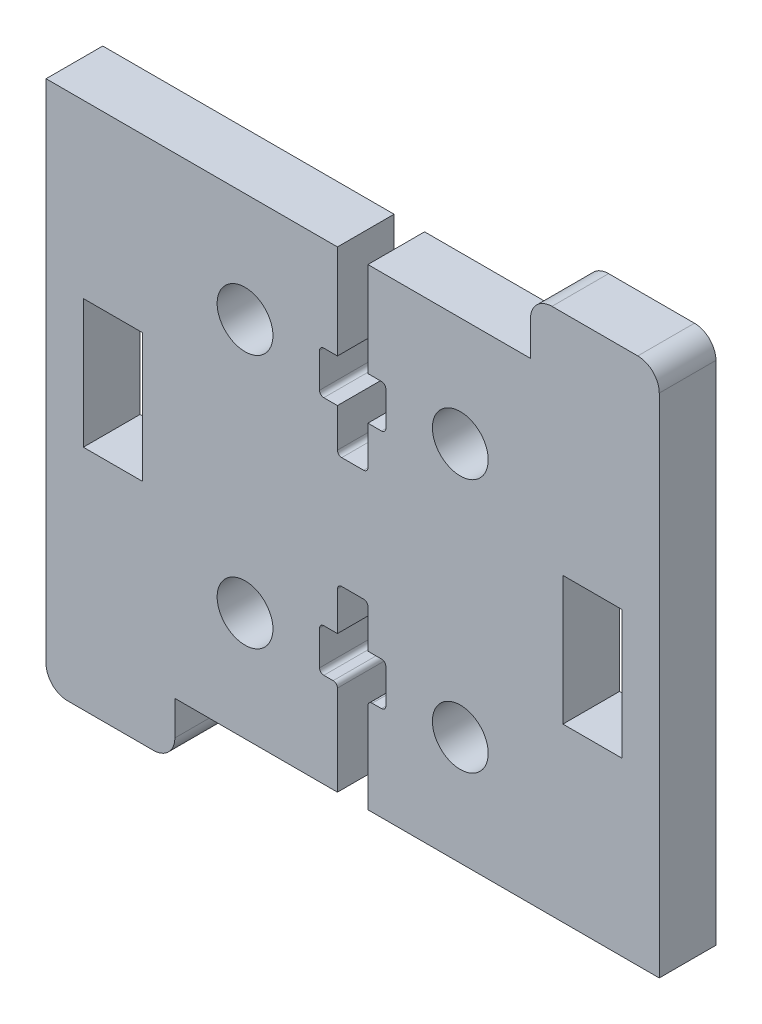
from build123d import *

# Parameters (mm, degrees)
MODEL_R             = 3.25
MODEL_W             = 6.88
MODEL_H             = 15
BOSS_EXTRUDE1_DEPTH = 6.6


with BuildPart() as part:
    # Model → Boss-Extrude1 (new body)
    with BuildSketch(Plane.XY):
        with BuildLine():
            Line((39.57, 15.5), (39.57, 11.5))
            ThreePointArc((39.57, 11.5), (39.423553391, 11.146446609), (39.07, 11))
            Line((39.07, 11), (37.985, 11))
            ThreePointArc((37.985, 11), (37.631446609, 10.853553391), (37.485, 10.5))
            Line((37.485, 10.5), (37.485, 0))
            Line((37.485, 0), (71.42, 0))
            Line((71.42, 0), (71.42, 59))
            ThreePointArc((71.42, 59), (70.687766953, 60.767766953), (68.92, 61.5))
            Line((68.92, 61.5), (58.92, 61.5))
            ThreePointArc((58.92, 61.5), (57.152233047, 60.767766953), (56.42, 59))
            Line((56.42, 59), (56.42, 55))
            Line((56.42, 55), (37.485, 55))
            Line((37.485, 55), (37.485, 44))
            Line((37.485, 44), (39.07, 44))
            ThreePointArc((39.07, 44), (39.423553391, 43.853553391), (39.57, 43.5))
            Line((39.57, 43.5), (39.57, 39.5))
            ThreePointArc((39.57, 39.5), (39.423553391, 39.146446609), (39.07, 39))
            Line((39.07, 39), (37.485, 39))
            Line((37.485, 39), (37.485, 34.5))
            ThreePointArc((37.485, 34.5), (37.338553391, 34.146446609), (36.985, 34))
            Line((36.985, 34), (34.435, 34))
            ThreePointArc((34.435, 34), (34.081446609, 34.146446609), (33.935, 34.5))
            Line((33.935, 34.5), (33.935, 39))
            Line((33.935, 39), (32.35, 39))
            ThreePointArc((32.35, 39), (31.996446609, 39.146446609), (31.85, 39.5))
            Line((31.85, 39.5), (31.85, 43.5))
            ThreePointArc((31.85, 43.5), (31.996446609, 43.853553391), (32.35, 44))
            Line((32.35, 44), (33.935, 44))
            Line((33.935, 44), (33.935, 55))
            Line((33.935, 55), (0, 55))
            Line((0, 55), (0, -4))
            ThreePointArc((0, -4), (0.732233047, -5.767766953), (2.5, -6.5))
            Line((2.5, -6.5), (12.5, -6.5))
            ThreePointArc((12.5, -6.5), (14.267766953, -5.767766953), (15, -4))
            Line((15, -4), (15, 0))
            Line((15, 0), (33.935, 0))
            Line((33.935, 0), (33.935, 10.5))
            ThreePointArc((33.935, 10.5), (33.788553391, 10.853553391), (33.435, 11))
            Line((33.435, 11), (32.35, 11))
            ThreePointArc((32.35, 11), (31.996446609, 11.146446609), (31.85, 11.5))
            Line((31.85, 11.5), (31.85, 15.5))
            ThreePointArc((31.85, 15.5), (31.996446609, 15.853553391), (32.35, 16))
            Line((32.35, 16), (33.935, 16))
            Line((33.935, 16), (33.935, 20.5))
            ThreePointArc((33.935, 20.5), (34.081446609, 20.853553391), (34.435, 21))
            Line((34.435, 21), (36.985, 21))
            ThreePointArc((36.985, 21), (37.338553391, 20.853553391), (37.485, 20.5))
            Line((37.485, 20.5), (37.485, 16))
            Line((37.485, 16), (39.07, 16))
            ThreePointArc((39.07, 16), (39.423553391, 15.853553391), (39.57, 15.5))
        make_face()
        with Locations((23.174807377, 12.7)):
            Circle(MODEL_R, mode=Mode.SUBTRACT)
        with Locations((23.174807377, 42.3)):
            Circle(MODEL_R, mode=Mode.SUBTRACT)
        with Locations((48.245192623, 12.7)):
            Circle(MODEL_R, mode=Mode.SUBTRACT)
        with Locations((48.245192623, 42.3)):
            Circle(MODEL_R, mode=Mode.SUBTRACT)
        with Locations((7.78, 27.5)):
            Rectangle(MODEL_W, MODEL_H, mode=Mode.SUBTRACT)
        with Locations((63.64, 27.5)):
            Rectangle(MODEL_W, MODEL_H, mode=Mode.SUBTRACT)
    extrude(amount=BOSS_EXTRUDE1_DEPTH)


solid = part.part
